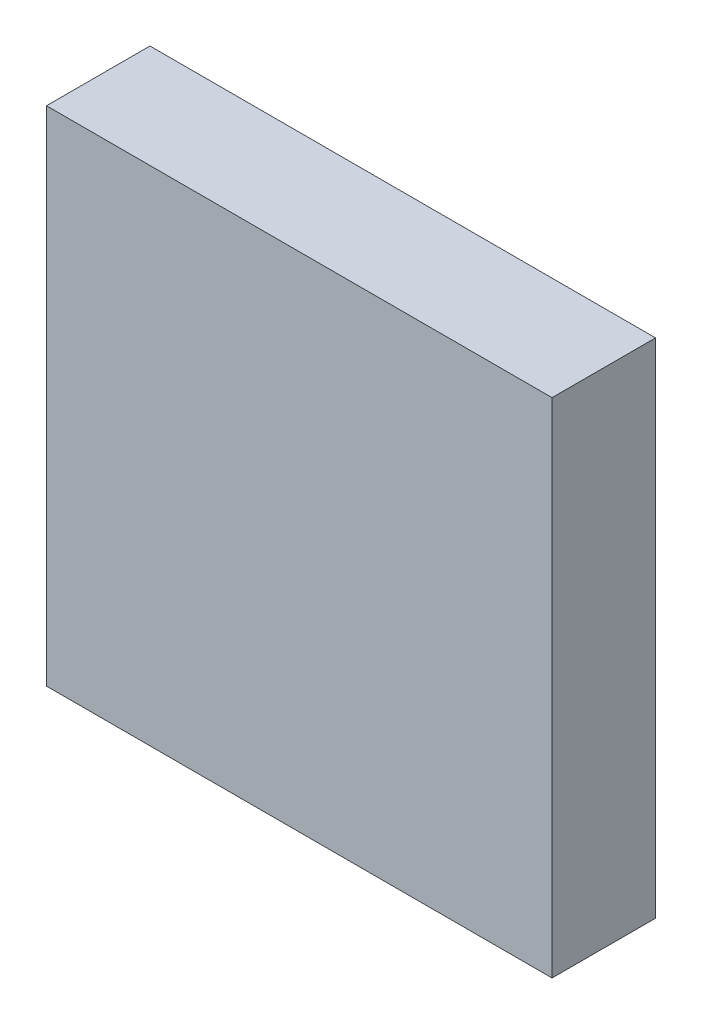
from build123d import *

# Parameters (mm, degrees)
SKETCH_1_W      = 1710
SKETCH_1_H      = 350
EXTRUDE_1_DEPTH = 1700


with BuildPart() as part:
    # ｽｹｯﾁ1 → ﾎﾞｽ - 押し出し1 (new body)
    with BuildSketch(Plane(origin=(0, 0, 0), x_dir=(1, 0, 0), z_dir=(0, 1, 0))):
        with Locations((804.369138566, 100.863389704)):
            Rectangle(SKETCH_1_W, SKETCH_1_H)
    extrude(amount=EXTRUDE_1_DEPTH)


solid = part.part
